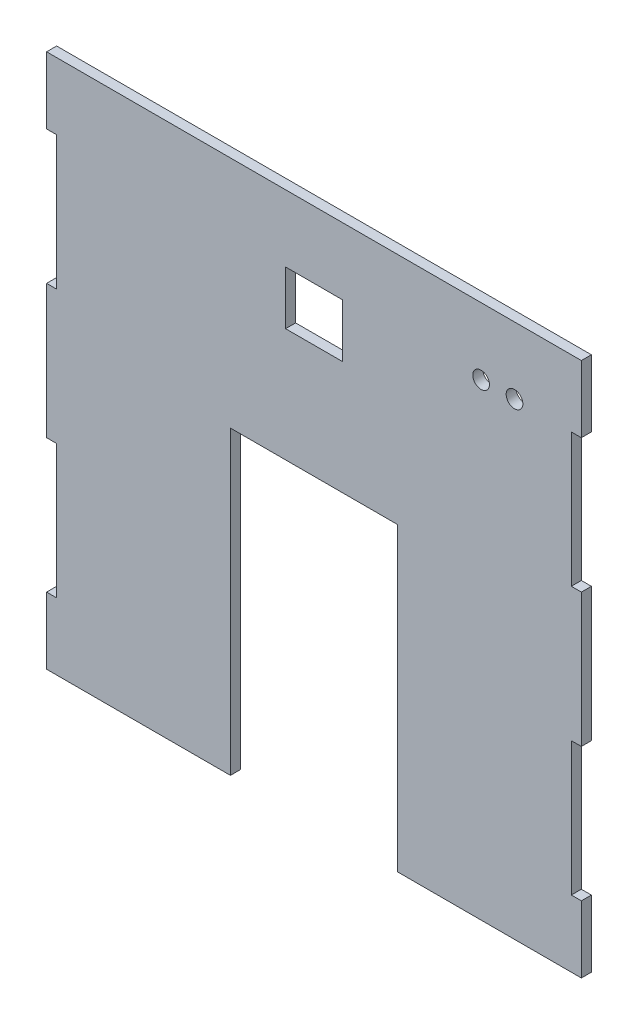
from build123d import *

# Parameters (mm, degrees)
SKETCH1_W           = 17
SKETCH1_H           = 16
SKETCH1_R           = 2.5
BOSS_EXTRUDE1_DEPTH = 3
SKETCH2_W           = 3
SKETCH2_H           = 40
CUT_EXTRUDE1_DEPTH  = 114.176852757


with BuildPart() as part:
    # Sketch1 → Boss-Extrude1 (new body)
    with BuildSketch(Plane.XY):
        Polygon((80, 80), (-80, 80), (-80, -80), (-25, -80), (-25, 10), (25, 10), (25, -80), (80, -80), align=None)
        with Locations((0, 52)):
            Rectangle(SKETCH1_W, SKETCH1_H, mode=Mode.SUBTRACT)
        with Locations((50, 60)):
            Circle(SKETCH1_R, mode=Mode.SUBTRACT)
        with Locations((60, 60)):
            Circle(SKETCH1_R, mode=Mode.SUBTRACT)
    extrude(amount=BOSS_EXTRUDE1_DEPTH)

    # Sketch2 → Cut-Extrude1 (cut, through all)
    with BuildSketch(Plane.XY.offset(3)):
        with Locations((-78.5, 40)):
            Rectangle(SKETCH2_W, SKETCH2_H)
        with Locations((-78.5, -40)):
            Rectangle(SKETCH2_W, SKETCH2_H)
        with Locations((78.5, -40)):
            Rectangle(SKETCH2_W, SKETCH2_H)
        with Locations((78.5, 40)):
            Rectangle(SKETCH2_W, SKETCH2_H)
    extrude(amount=-CUT_EXTRUDE1_DEPTH, mode=Mode.SUBTRACT)


solid = part.part
